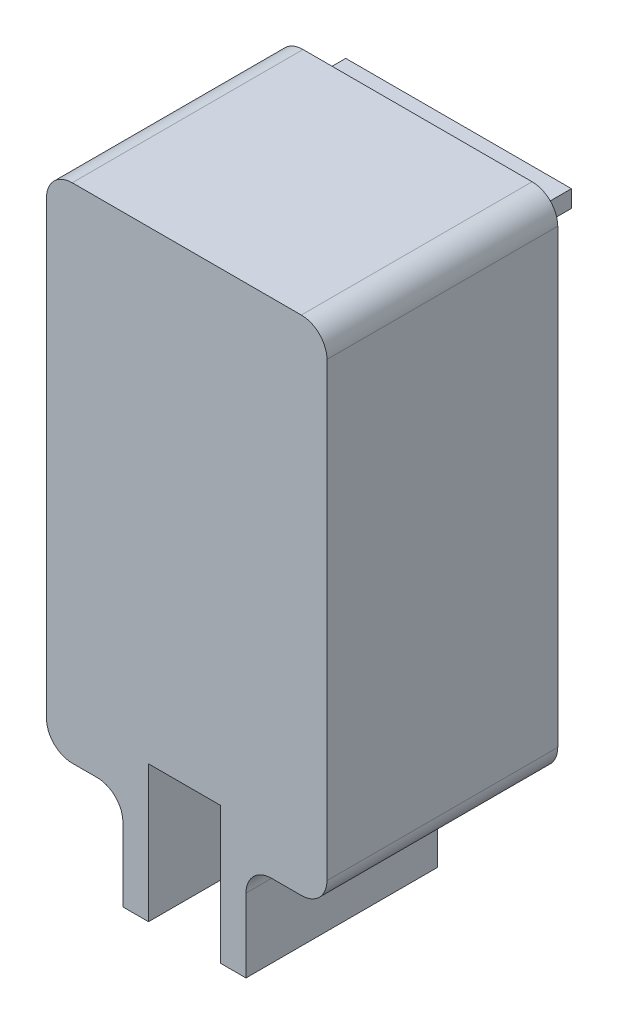
from build123d import *

# Parameters (mm, degrees)
BOSS_EXTRUDE1_DEPTH   = 14
BOSS_EXTRUDE1_2_DEPTH = 14
BOSS_EXTRUDE2_START   = 2
SKETCH1_3_W           = 1.2
SKETCH1_3_H           = 25
BOSS_EXTRUDE2_DEPTH   = 12
SKETCH2_W             = 14.2
SKETCH2_H             = 27
SKETCH2_W_2           = 12
SKETCH2_H_2           = 25
BOSS_EXTRUDE3_DEPTH   = 1.5
SKETCH3_W             = 4.2
SKETCH3_H             = 8.2
SKETCH3_H_2           = 1.5
CUT_EXTRUDE1_DEPTH    = 1
BOSS_EXTRUDE4_DEPTH   = 7
FILLET2_R             = 2
SKETCH5_W             = 13.2
SKETCH5_H             = 1
CUT_EXTRUDE2_DEPTH    = 2
FILLET4_R             = 1
BOSS_EXTRUDE7_START   = -13.5
BOSS_EXTRUDE7_DEPTH   = 13.5
BOSS_EXTRUDE8_DEPTH   = 2.3
FILLET5_R             = 1.5
SKETCH10_W            = 0.4
SKETCH10_H            = 29.4
CUT_EXTRUDE3_DEPTH    = 13.5
FILLET6_R             = 1.5


with BuildPart() as part:
    # Sketch1 → Boss-Extrude1 (new body)
    with BuildSketch(Plane.XY):
        Polygon((7.2, 13.5), (-6, 13.5), (-6, 12.5), (6, 12.5), (7.2, 12.5), align=None)
    extrude(amount=BOSS_EXTRUDE1_DEPTH)



with BuildPart() as body_2:
    # Sketch1 → Boss-Extrude1 2 (new body)
    with BuildSketch(Plane.XY):
        Polygon((6, -12.5), (-6, -12.5), (-6, -13.5), (7.2, -13.5), (7.2, -12.5), align=None)
    extrude(amount=BOSS_EXTRUDE1_2_DEPTH)


with BuildPart() as part_1:
    add(part.part)

    add(body_2.part)  # Boss-Extrude2 merges body 2
    # Sketch1<3> → Boss-Extrude2 (add)
    with BuildSketch(Plane.XY.offset(BOSS_EXTRUDE2_START)):
        Polygon((-6, 12.5), (-6, 13.5), (-7, 13.5), (-7, -13.5), (-6, -13.5), (-6, -12.5), align=None)
        with Locations((6.6, 0)):
            Rectangle(SKETCH1_3_W, SKETCH1_3_H)
    extrude(amount=BOSS_EXTRUDE2_DEPTH)

    # Sketch2 → Boss-Extrude3 (add)
    # profile 1 of 2: a face of its own
    with BuildSketch(Plane.XY.offset(14)):
        with Locations((0.1, 0)):
            Rectangle(SKETCH2_W, SKETCH2_H)
        Rectangle(SKETCH2_W_2, SKETCH2_H_2, mode=Mode.SUBTRACT)
    # profile 2 of 2: a face of its own
    with BuildSketch(Plane.XY.offset(14)):
        Rectangle(SKETCH2_W_2, SKETCH2_H_2)
    extrude(amount=BOSS_EXTRUDE3_DEPTH)

    # Sketch3 → Cut-Extrude1 (cut)
    with BuildSketch(Plane.XZ.offset(13.5)):
        with Locations((0.063870968, 9.9)):
            Rectangle(SKETCH3_W, SKETCH3_H)
        with Locations((0.063870968, 14.75)):
            Rectangle(SKETCH3_W, SKETCH3_H_2)
    extrude(amount=-CUT_EXTRUDE1_DEPTH, mode=Mode.SUBTRACT)

    # Sketch4 → Boss-Extrude4 (add)
    with BuildSketch(Plane.XZ.offset(13.5)):
        Polygon((3.663870968, 15.5), (2.163870968, 15.5), (2.163870968, 5.8), (-2.036129032, 5.8), (-2.036129032, 15.5), (-3.536129032, 15.5), (-3.536129032, 4.3), (3.663870968, 4.3), align=None)
    extrude(amount=BOSS_EXTRUDE4_DEPTH)

    # Fillet2
    fillet2_edges = [part_1.edges().sort_by_distance(p)[0] for p in [
        (-6, -12.5, 8),
        (6, -12.5, 8),
        (6, 12.5, 8),
        (-6, 12.5, 8),
    ]]
    fillet(fillet2_edges, radius=FILLET2_R)

    # Sketch5 → Cut-Extrude2 (cut)
    with BuildSketch(Plane(origin=(0, 0, 2), x_dir=(-1, 0, 0), z_dir=(0, 0, -1))):
        with Locations((-0.6, -13)):
            Rectangle(SKETCH5_W, SKETCH5_H)
    extrude(amount=CUT_EXTRUDE2_DEPTH, mode=Mode.SUBTRACT)

    # Fillet4
    fillet4_edges = [part_1.edges().sort_by_distance(p)[0] for p in [
        (3.663870968, -13.5, 9.9),
        (0.063870968, -13.5, 4.3),
        (-3.536129032, -13.5, 9.9),
    ]]
    fillet(fillet4_edges, radius=FILLET4_R)

    # Sketch8 → Boss-Extrude7 (add)
    with BuildSketch(Plane.XY.offset(15.5).offset(BOSS_EXTRUDE7_START)):
        with BuildLine():
            Line((8.4, -14.7), (8.4, 14.7))
            Line((8.4, 14.7), (-8.4, 14.7))
            Line((-8.4, 14.7), (-8.4, -14.7))
            Line((-8.4, -14.7), (-3.536129032, -14.7))
            Line((-3.536129032, -14.7), (-3.536129032, -14.5))
            ThreePointArc((-3.536129032, -14.5), (-3.829022251, -13.792893219), (-4.536129032, -13.5))
            Line((-4.536129032, -13.5), (-7, -13.5))
            Line((-7, -13.5), (-7, 13.5))
            Line((-7, 13.5), (7.2, 13.5))
            Line((7.2, 13.5), (7.2, -13.5))
            Line((7.2, -13.5), (4.663870968, -13.5))
            ThreePointArc((4.663870968, -13.5), (3.956764187, -13.792893219), (3.663870968, -14.5))
            Line((3.663870968, -14.5), (3.663870968, -14.7))
            Line((3.663870968, -14.7), (8.4, -14.7))
        make_face()
    extrude(amount=BOSS_EXTRUDE7_DEPTH)

    # Sketch9 → Boss-Extrude8 (add)
    with BuildSketch(Plane(origin=(0, 0, 2), x_dir=(-1, 0, 0), z_dir=(0, 0, -1))):
        Polygon((-5.007987006, -14.7), (5.670470917, -14.7), (5.670470917, -12.839003899), (-4.79710184, -12.839003899), align=None)
    extrude(amount=-BOSS_EXTRUDE8_DEPTH)

    # Fillet5
    fillet5_edges = [part_1.edges().sort_by_distance(p)[0] for p in [
        (3.663870968, -14.7, 9.9),
        (-3.536129032, -14.7, 9.9),
        (0.063870968, -14.7, 4.3),
    ]]
    fillet(fillet5_edges, radius=FILLET5_R)

    # Sketch10 → Cut-Extrude3 (cut)
    with BuildSketch(Plane(origin=(0, 0, 2), x_dir=(-1, 0, 0), z_dir=(0, 0, -1))):
        with Locations((8.2, 0)):
            Rectangle(SKETCH10_W, SKETCH10_H)
    extrude(amount=-CUT_EXTRUDE3_DEPTH, mode=Mode.SUBTRACT)

    # Fillet6
    fillet6_edges = [part_1.edges().sort_by_distance(p)[0] for p in [
        (8.4, 14.7, 8.75),
        (8.4, -14.7, 8.75),
        (-8, 14.7, 8.75),
        (-8, -14.7, 8.75),
    ]]
    fillet(fillet6_edges, radius=FILLET6_R)


solid = part_1.part
